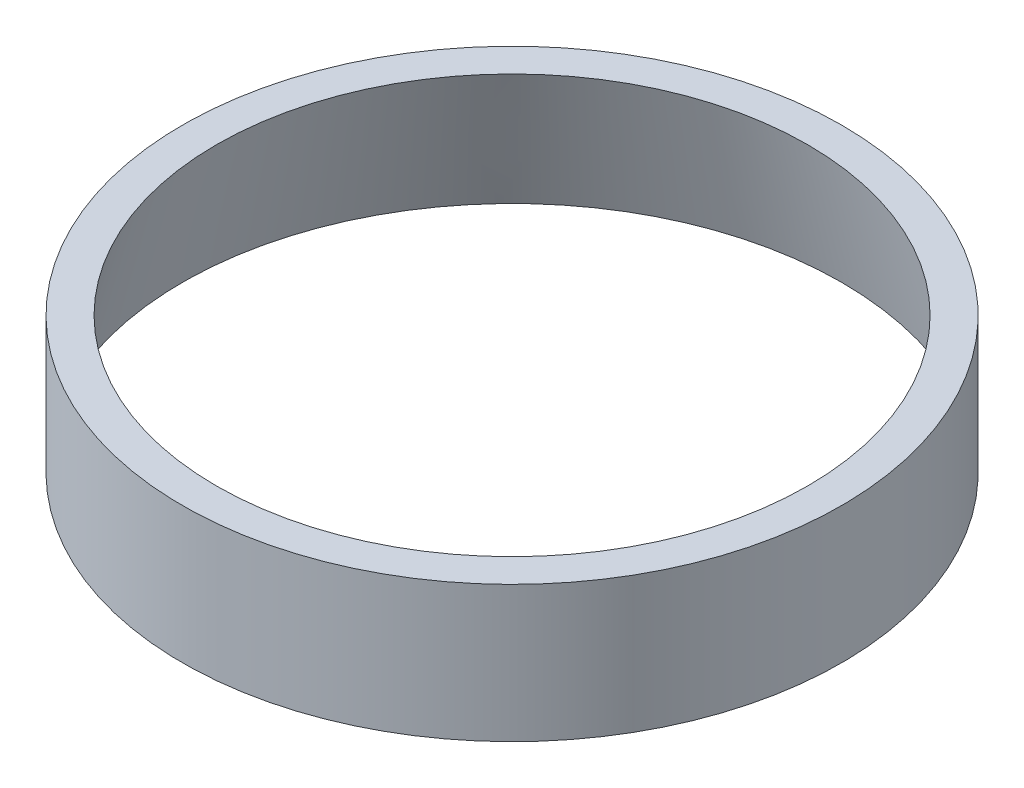
from build123d import *


with BuildPart() as part:
    # Sketch1 → Revolve1 (revolve)
    with BuildSketch(Plane.XY, mode=Mode.PRIVATE) as revolve1_sk:
        Polygon((37.5, 0), (33.635415956, 15.5), (37.5, 15.5), align=None)
    revolve(revolve1_sk.sketch.rotate(Axis((0, 0, 0), (0, 1, 0)), 90), axis=Axis((0, 0, 0), (0, 1, 0)))


solid = part.part
